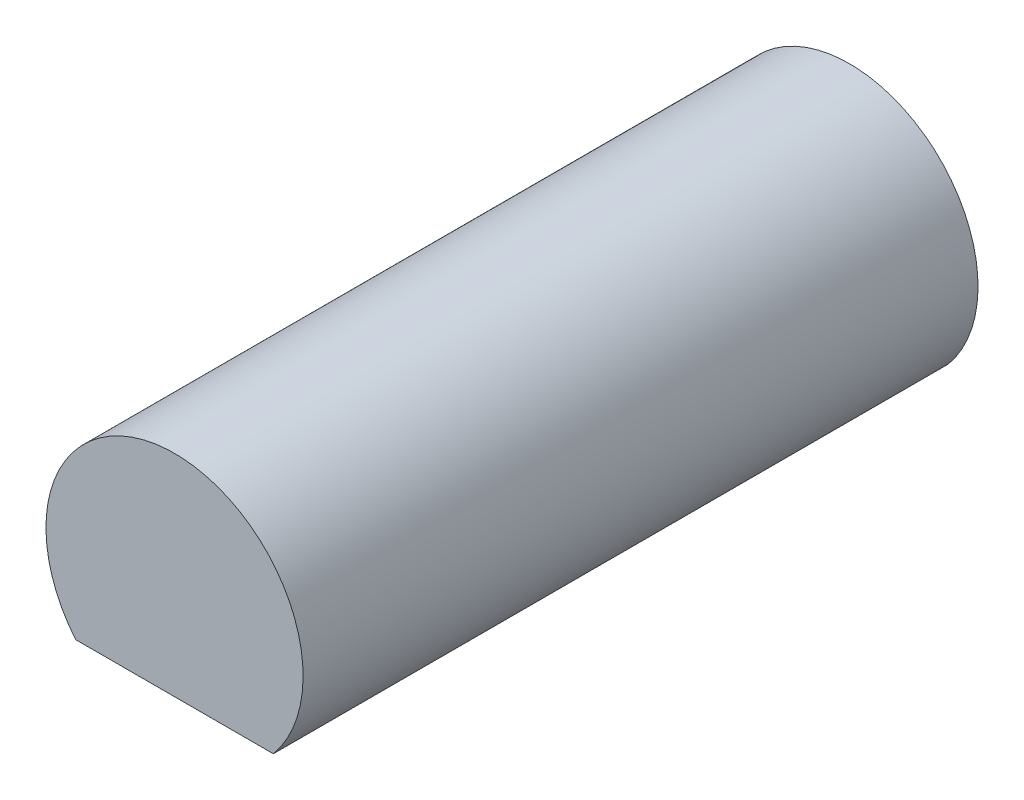
from build123d import *

# Parameters (mm, degrees)
BOSS_EXTRUDE1_DEPTH = 10.5


with BuildPart() as part:
    # Sketch1 → Boss-Extrude1 (new, symmetric)
    with BuildSketch(Plane.XY):
        with BuildLine():
            Line((3.075, -2.558197608), (-3.075, -2.558197608))
            ThreePointArc((-3.075, -2.558197608), (0, 4), (3.075, -2.558197608))
        make_face()
    extrude(amount=BOSS_EXTRUDE1_DEPTH, both=True)


solid = part.part
